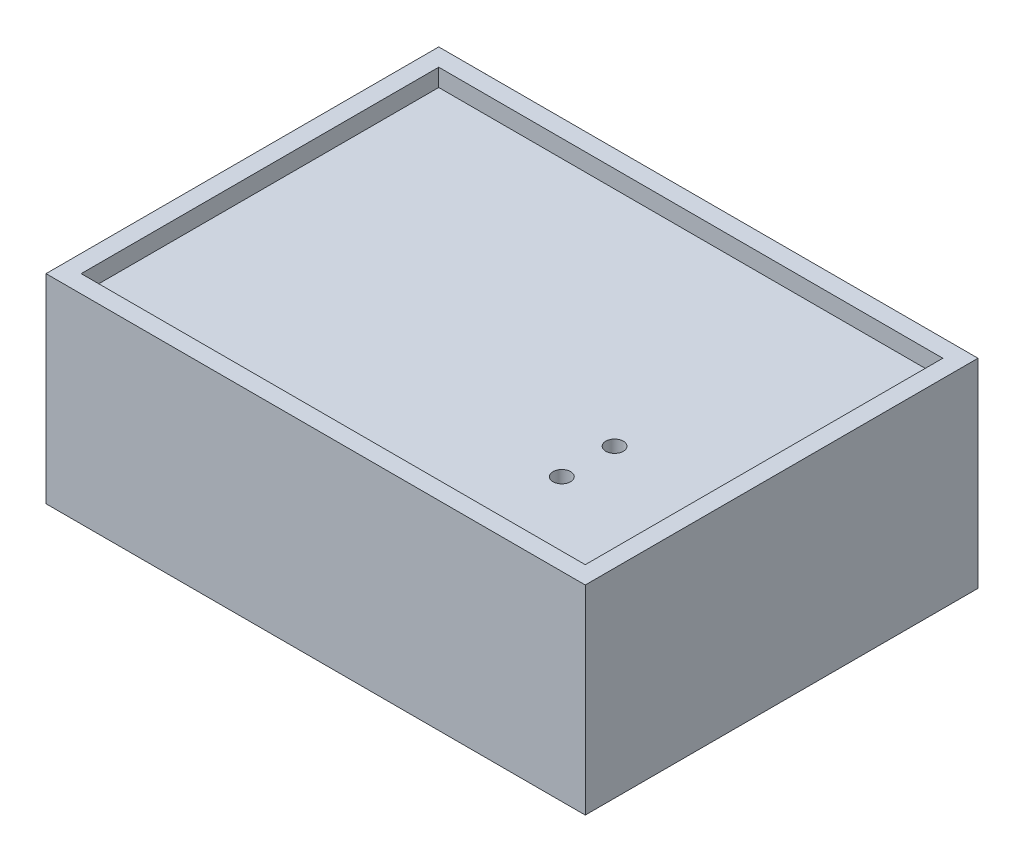
from build123d import *

# Parameters (mm, degrees)
SKETCH_1_W          = 92
SKETCH_1_H          = 67
EXTRUDE_1_DEPTH     = 34
SKETCH_2_W          = 86
SKETCH_2_H          = 61
CUT_EXTRUDE_1_DEPTH = 3
SKETCH_3_R          = 1.5
CUT_EXTRUDE_2_DEPTH = 3
SKETCH_4_W          = 86
SKETCH_4_H          = 61
CUT_EXTRUDE_3_DEPTH = 3
SKETCH_5_R          = 1.5
CUT_EXTRUDE_4_DEPTH = 3


with BuildPart() as part:
    # 草图1 → 凸台-拉伸1 (new body)
    with BuildSketch(Plane(origin=(0, 0, 0), x_dir=(1, 0, 0), z_dir=(0, 1, 0))):
        Rectangle(SKETCH_1_W, SKETCH_1_H)
    extrude(amount=EXTRUDE_1_DEPTH)

    # 草图2 → 切除-拉伸1 (cut)
    with BuildSketch(Plane(origin=(0, 34, 0), x_dir=(1, 0, 0), z_dir=(0, 1, 0))):
        Rectangle(SKETCH_2_W, SKETCH_2_H)
    extrude(amount=-CUT_EXTRUDE_1_DEPTH, mode=Mode.SUBTRACT)

    # 草图3 → 切除-拉伸2 (cut)
    with BuildSketch(Plane(origin=(0, 31, 0), x_dir=(1, 0, 0), z_dir=(0, 1, 0))):
        with Locations(Location((25, -16.5, 0), (0, 0, 270))):
            Circle(SKETCH_3_R)
        with Locations(Location((25, -7.5, 0), (0, 0, 270))):
            Circle(SKETCH_3_R)
    extrude(amount=-CUT_EXTRUDE_2_DEPTH, mode=Mode.SUBTRACT)

    # 草图4 → 切除-拉伸3 (cut)
    with BuildSketch(Plane.XZ):
        Rectangle(SKETCH_4_W, SKETCH_4_H)
    extrude(amount=-CUT_EXTRUDE_3_DEPTH, mode=Mode.SUBTRACT)

    # 草图5 → 切除-拉伸4 (cut)
    with BuildSketch(Plane.XZ.offset(-3)):
        with Locations(Location((-39, 24.5, 0), (0, 0, 270))):
            Circle(SKETCH_5_R)
        with Locations(Location((19, 24.5, 0), (0, 0, 90))):
            Circle(SKETCH_5_R)
        with Locations(Location((19, -24.5, 0), (0, 0, 270))):
            Circle(SKETCH_5_R)
        with Locations(Location((-39, -24.5, 0), (0, 0, 90))):
            Circle(SKETCH_5_R)
    extrude(amount=-CUT_EXTRUDE_4_DEPTH, mode=Mode.SUBTRACT)


solid = part.part
